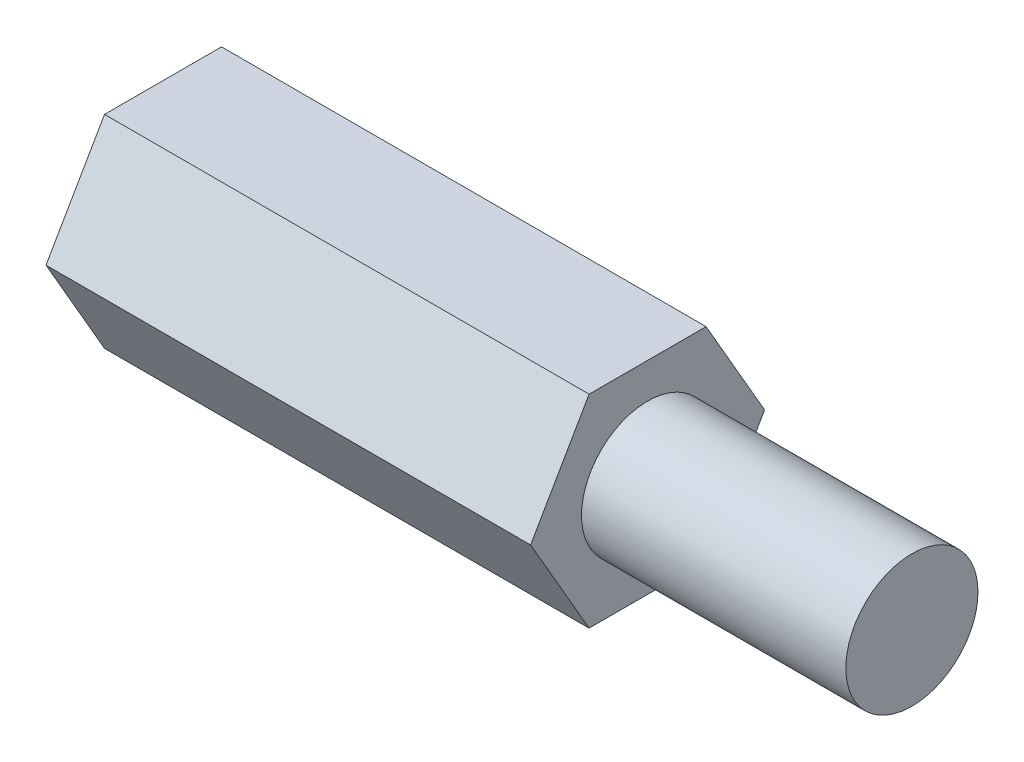
from build123d import *

# Parameters (mm, degrees)
SKETCH1_R           = 1.5
BOSS_EXTRUDE1_DEPTH = 11
SKETCH2_R           = 1.5
BOSS_EXTRUDE2_DEPTH = 6
BOSS_EXTRUDE3_DEPTH = 2


with BuildPart() as part:
    # Sketch1 → Boss-Extrude1 (new body)
    with BuildSketch(Plane(origin=(0, 0, 0), x_dir=(0, 0, -1), z_dir=(1, 0, 0))):
        Polygon((1.327905619, 2.3), (-1.327905619, 2.3), (-2.655811238, 0), (-1.327905619, -2.3), (1.327905619, -2.3), (2.655811238, 0), align=None)
        Circle(SKETCH1_R, mode=Mode.SUBTRACT)
    extrude(amount=BOSS_EXTRUDE1_DEPTH)



with BuildPart() as body_2:
    # Sketch2 → Boss-Extrude2 (new body)
    with BuildSketch(Plane(origin=(11, 0, 0), x_dir=(0, 0, -1), z_dir=(1, 0, 0))):
        Circle(SKETCH2_R)
    extrude(amount=BOSS_EXTRUDE2_DEPTH)


with BuildPart() as part_1:
    add(part.part)

    add(body_2.part)  # Boss-Extrude3 merges body 2
    # Sketch3 → Boss-Extrude3 (add)
    with BuildSketch(Plane.ZY.offset(-11)):
        Polygon((-1.327905619, 2.3), (-2.655811238, 0), (-1.327905619, -2.3), (1.327905619, -2.3), (2.655811238, 0), (1.327905619, 2.3), align=None)
    extrude(amount=BOSS_EXTRUDE3_DEPTH)


solid = part_1.part
